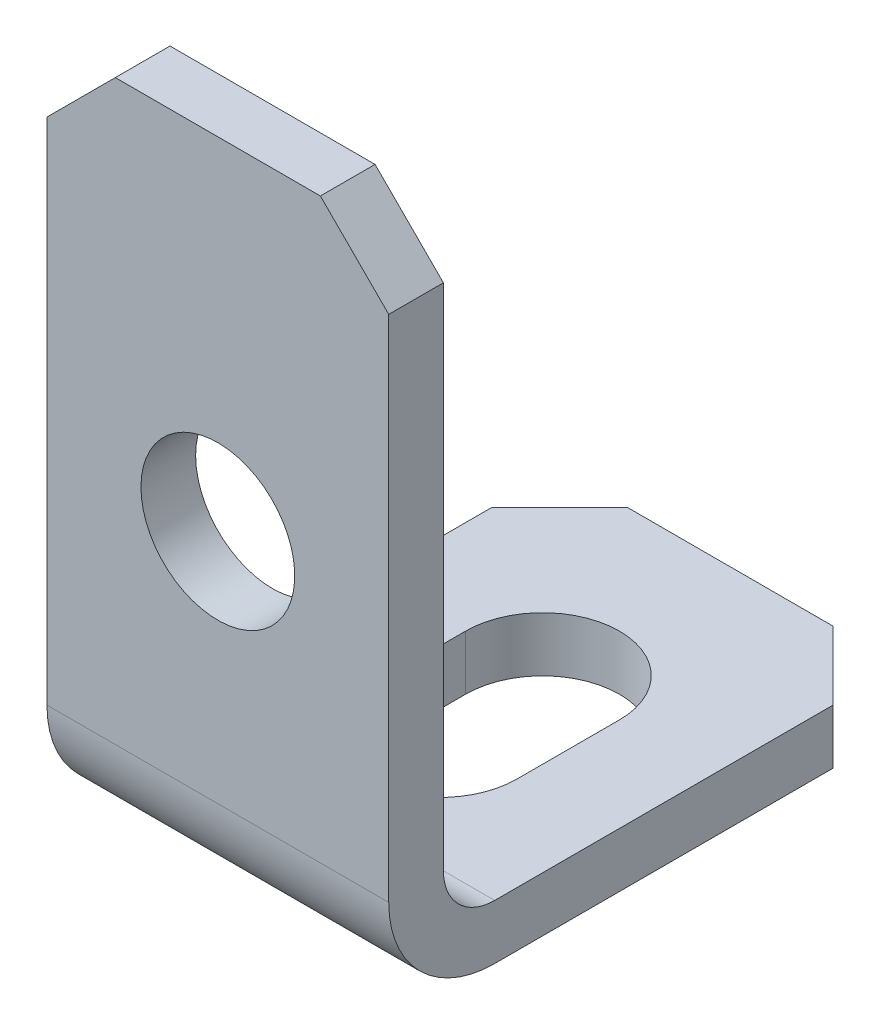
from build123d import *

# Parameters (mm, degrees)
SKETCH1_W                  = 15
SKETCH1_H                  = 20
BOSS_EXTRUDE1_DEPTH        = 10
SKETCH2_W                  = 13.4
SKETCH2_H                  = 18.4
CUT_EXTRUDE1_DEPTH         = 27.925824036
CUT_EXTRUDE2_DEPTH         = 27.925824036
F_4_5_4_5_DIAMETER_HOLE1_D = 4.5
CHAMFER1_SIZE              = 2
FILLET1_R                  = 1.5
FILLET2_R                  = 3.1


with BuildPart() as part:
    # Sketch1 → Boss-Extrude1 (new body)
    with BuildSketch(Plane(origin=(10, 0, 0), x_dir=(0, 0, -1), z_dir=(1, 0, 0))):
        with Locations((7.5, 10)):
            Rectangle(SKETCH1_W, SKETCH1_H)
    extrude(amount=-BOSS_EXTRUDE1_DEPTH)

    # Sketch2 → Cut-Extrude1 (cut, through all)
    with BuildSketch(Plane.ZY):
        with Locations((-8.3, 10.8)):
            Rectangle(SKETCH2_W, SKETCH2_H)
    extrude(amount=-CUT_EXTRUDE1_DEPTH, mode=Mode.SUBTRACT)

    # Sketch3 → Cut-Extrude2 (cut, through all)
    with BuildSketch(Plane.XZ):
        with BuildLine():
            Line((7.25, -9.5), (7.25, -6.5))
            ThreePointArc((7.25, -6.5), (5, -4.25), (2.75, -6.5))
            Line((2.75, -6.5), (2.75, -9.5))
            ThreePointArc((2.75, -9.5), (5, -11.75), (7.25, -9.5))
        make_face()
    extrude(amount=-CUT_EXTRUDE2_DEPTH, mode=Mode.SUBTRACT)

    # Ø4.5 (4.5) Diameter Hole1 (through all)
    with Locations(Plane(origin=(0, 0, -1.6), x_dir=(-1, 0, 0), z_dir=(0, 0, -1))):
        with Locations((-5, 10)):
            Hole(F_4_5_4_5_DIAMETER_HOLE1_D / 2)

    # Chamfer1
    chamfer1_edges = [part.edges().sort_by_distance(p)[0] for p in [
        (0, 0.8, -15),
        (10, 20, -0.8),
        (0, 20, -0.8),
        (10, 0.8, -15),
    ]]
    chamfer(chamfer1_edges, length=CHAMFER1_SIZE)

    # Fillet1
    fillet1_edges = [part.edges().sort_by_distance(p)[0] for p in [
        (5, 1.6, -1.6),
    ]]
    fillet(fillet1_edges, radius=FILLET1_R)

    # Fillet2
    fillet2_edges = [part.edges().sort_by_distance(p)[0] for p in [
        (5, 0, 0),
    ]]
    fillet(fillet2_edges, radius=FILLET2_R)


solid = part.part
